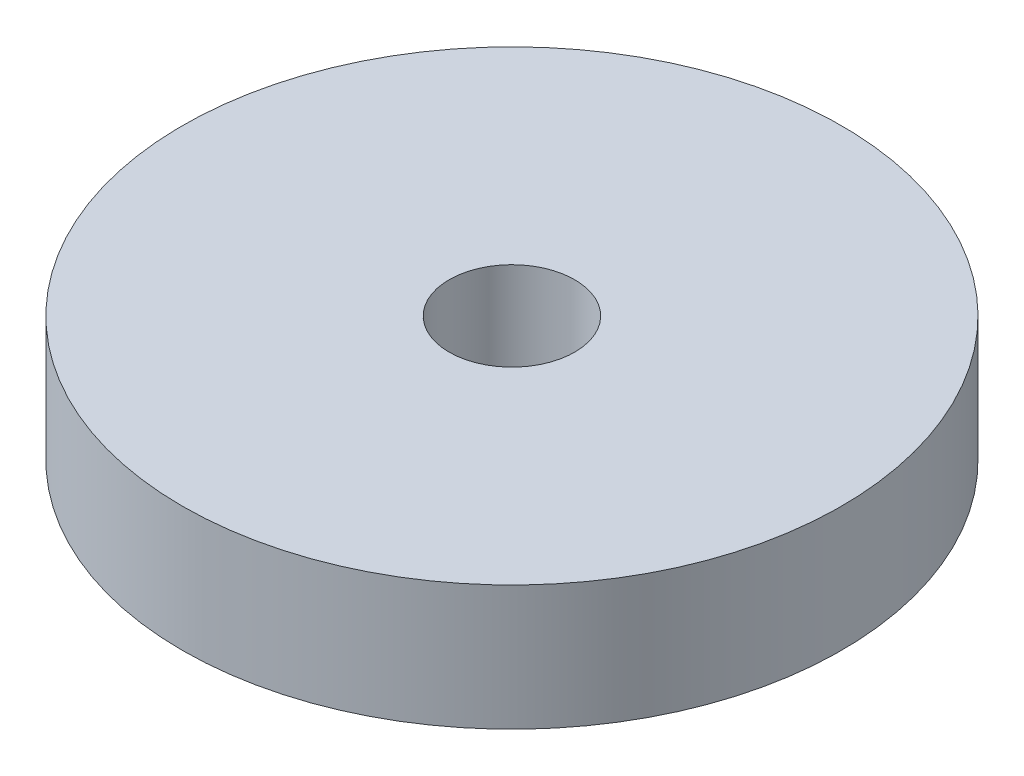
from build123d import *

# Parameters (mm, degrees)
SKETCH1_R          = 14.986
BASE_DEPTH         = 10.16
SKETCH2_R          = 31.496
GEAR_DEPTH         = 11.938
SKETCH3_R          = 6
CUT_EXTRUDE1_DEPTH = 50.722405774


with BuildPart() as part:
    # Sketch1 → Base (new body)
    with BuildSketch(Plane(origin=(0, 0, 0), x_dir=(1, 0, 0), z_dir=(0, 1, 0))):
        with Locations(Location((0, 0, 0), (0, 0, 270))):
            Circle(SKETCH1_R)
    extrude(amount=BASE_DEPTH)

    # Sketch2 → Gear (add)
    with BuildSketch(Plane(origin=(0, 10.16, 0), x_dir=(1, 0, 0), z_dir=(0, 1, 0))):
        with Locations(Location((0, 0, 0), (0, 0, 270))):
            Circle(SKETCH2_R)
    extrude(amount=GEAR_DEPTH)

    # Sketch3 → Cut-Extrude1 (cut, through all)
    with BuildSketch(Plane(origin=(0, 22.098, 0), x_dir=(1, 0, 0), z_dir=(0, 1, 0))):
        with Locations(Location((0, 0, 0), (0, 0, 270))):
            Circle(SKETCH3_R)
    extrude(amount=-CUT_EXTRUDE1_DEPTH, mode=Mode.SUBTRACT)


solid = part.part
